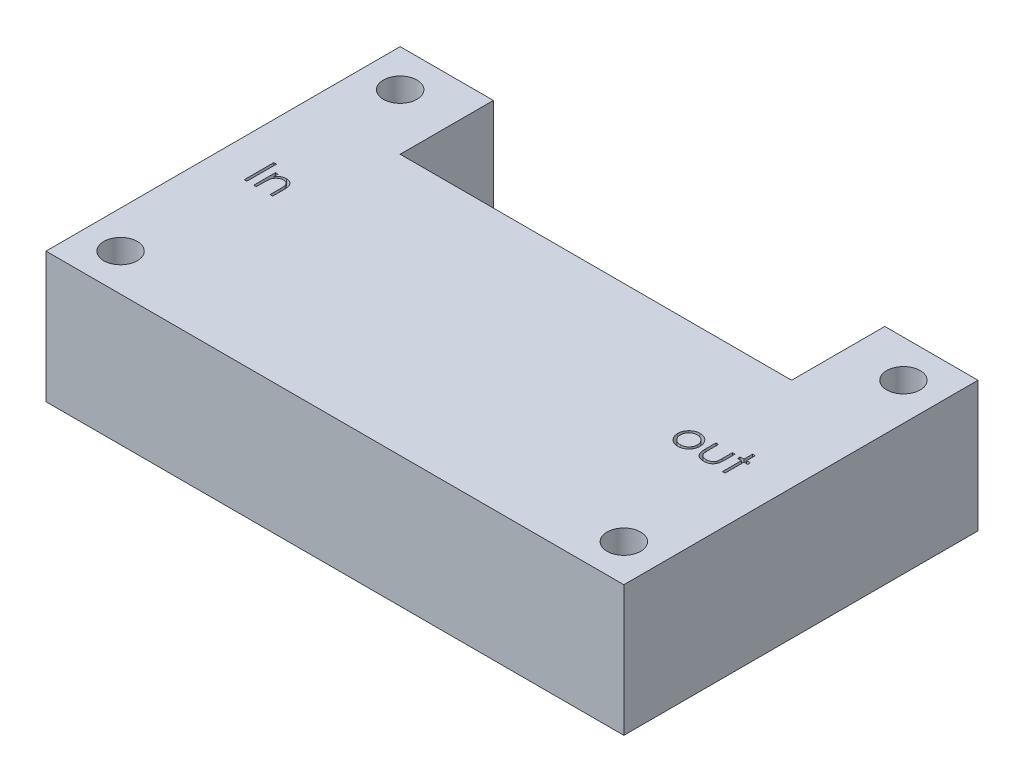
from build123d import *

# Parameters (mm, degrees)
ESQUISSE1_W             = 62
ESQUISSE1_H             = 38
BOSS_EXTRU_1_DEPTH      = 14
ESQUISSE2_W             = 42
ESQUISSE2_H             = 10
ENL_V_MAT_EXTRU_1_DEPTH = 14
D_GAGEMENT_M31_D        = 3.6
ESQUISSE5_W             = 0.284935897
ESQUISSE5_H             = 3.175
ENL_V_MAT_EXTRU_2_DEPTH = 12


with BuildPart() as part:
    # Esquisse1 → Boss.-Extru.1 (new body)
    with BuildSketch(Plane(origin=(0, 0, 0), x_dir=(1, 0, 0), z_dir=(0, 1, 0))):
        Rectangle(ESQUISSE1_W, ESQUISSE1_H)
    extrude(amount=BOSS_EXTRU_1_DEPTH)

    # Esquisse2 → Enlèv. mat.-Extru.1 (cut)
    with BuildSketch(Plane(origin=(0, 14, 0), x_dir=(1, 0, 0), z_dir=(0, 1, 0))):
        with Locations((0, 14)):
            Rectangle(ESQUISSE2_W, ESQUISSE2_H)
    extrude(amount=-ENL_V_MAT_EXTRU_1_DEPTH, mode=Mode.SUBTRACT)

    # Dégagement M31 (through all)
    with Locations(Plane(origin=(0, 14, 0), x_dir=(1, 0, 0), z_dir=(0, 1, 0))):
        with Locations((-27, 15), (27, 15), (27, -15), (-27, -15)):
            Hole(D_GAGEMENT_M31_D / 2)

    # Esquisse5 → Enlèv. mat.-Extru.2 (cut)
    # profile 1 of 5: a face of its own
    with BuildSketch(Plane(origin=(0, 14, 0), x_dir=(1, 0, 0), z_dir=(0, 1, 0))):
        with Locations((-26.85828324, -0.141729763)):
            Rectangle(ESQUISSE5_W, ESQUISSE5_H)
    # profile 2 of 5: a face of its own
    with BuildSketch(Plane(origin=(0, 14, 0), x_dir=(1, 0, 0), z_dir=(0, 1, 0))):
        with BuildLine():
            Line((-25.983122983, 0.590962545), (-25.698187085, 0.590962545))
            Line((-25.698187085, 0.590962545), (-25.698187085, 0.172462945))
            add(Edge.make_bspline(
                [(-25.698187085, 0.172462945), (-25.667763659, 0.210420273), (-25.608725939, 0.28407779), (-25.510405866, 0.380888597), (-25.406498185, 0.46066748), (-25.297639224, 0.524261636), (-25.183681208, 0.572201075), (-25.065318777, 0.606823027), (-24.941843294, 0.627582836), (-24.857874126, 0.630295402), (-24.815394618, 0.631667673)],
                knots=[0, 0, 0, 0, 1.12780773, 2.188550248, 3.19190651, 4.159438251, 5.104880172, 6.052711206, 7.014878035, 8, 8, 8, 8], degree=3))
            add(Edge.make_bspline(
                [(-24.815394618, 0.631667673), (-24.772458971, 0.630084531), (-24.688423554, 0.626985941), (-24.566069884, 0.602477943), (-24.451794019, 0.560617605), (-24.346003422, 0.503275226), (-24.250638022, 0.431967926), (-24.166886192, 0.348893795), (-24.097613818, 0.253338919), (-24.051170496, 0.164690056), (-24.020576515, 0.086050936), (-24.001315752, 0.018698527), (-23.984959076, -0.056338653), (-23.970778847, -0.138833852), (-23.961183896, -0.229365067), (-23.953616246, -0.327561188), (-23.948192716, -0.433390406), (-23.947977535, -0.506584704), (-23.947866573, -0.544328922)],
                knots=[0, 0, 0, 0, 1.235846778, 2.418850247, 3.575807741, 4.728682307, 5.871620074, 6.994088408, 8.11269785, 9.256955736, 9.865816715, 10.540099792, 11.271859618, 12.076849838, 12.949306005, 13.892391288, 14.913166135, 16, 16, 16, 16], degree=3))
            Line((-23.947866573, -0.544328922), (-23.947866573, -1.729229763))
            Line((-23.947866573, -1.729229763), (-24.23280247, -1.729229763))
            Line((-24.23280247, -1.729229763), (-24.23280247, -0.637823513))
            add(Edge.make_bspline(
                [(-24.23280247, -0.637823513), (-24.232977737, -0.606234581), (-24.233312994, -0.545810329), (-24.234370402, -0.459297001), (-24.236919298, -0.380841319), (-24.240500982, -0.31063085), (-24.245743388, -0.248733013), (-24.251206775, -0.195021741), (-24.257887861, -0.149565227), (-24.263841361, -0.122201188), (-24.266511404, -0.109928881)],
                knots=[0, 0, 0, 0, 1.430800155, 2.736877192, 3.918605307, 4.986035426, 5.920637409, 6.731861385, 7.431261377, 8, 8, 8, 8], degree=3))
            add(Edge.make_bspline(
                [(-24.266511404, -0.109928881), (-24.276150279, -0.073905164), (-24.294702132, -0.004570653), (-24.340543673, 0.089476796), (-24.398432252, 0.169485152), (-24.469096729, 0.23495975), (-24.551854534, 0.285914723), (-24.646476013, 0.321269667), (-24.752048066, 0.343382426), (-24.826301684, 0.345584181), (-24.865003993, 0.346731776)],
                knots=[0, 0, 0, 0, 1.084156227, 2.086665306, 3.027808233, 3.945421172, 4.874247719, 5.839848303, 6.874090471, 8, 8, 8, 8], degree=3))
            add(Edge.make_bspline(
                [(-24.865003993, 0.346731776), (-24.887925391, 0.346299971), (-24.933286247, 0.345445442), (-25.000550864, 0.336871764), (-25.065796364, 0.322848737), (-25.129677554, 0.303917901), (-25.190916767, 0.277917129), (-25.251481517, 0.248408343), (-25.309091224, 0.211625322), (-25.364974306, 0.170630972), (-25.41696521, 0.125201977), (-25.465341631, 0.077264457), (-25.508465407, 0.026214445), (-25.547534848, -0.027125507), (-25.581260844, -0.08348796), (-25.610700431, -0.142329152), (-25.63567924, -0.20372653), (-25.648091397, -0.246339621), (-25.654301869, -0.267661253)],
                knots=[0, 0, 0, 0, 1.023777757, 2.026029729, 3.023749952, 4.003683103, 4.997618607, 5.993177895, 7.010360494, 8.046726602, 9.087585522, 10.09234134, 11.086953743, 12.070360549, 13.043493632, 14.017870808, 15.008233677, 16, 16, 16, 16], degree=3))
            add(Edge.make_bspline(
                [(-25.654301869, -0.267661253), (-25.657875693, -0.283314187), (-25.665655721, -0.317389806), (-25.674058749, -0.373310101), (-25.681685621, -0.437998436), (-25.688069147, -0.511379323), (-25.691974775, -0.593709681), (-25.696233264, -0.684637906), (-25.697783626, -0.78452657), (-25.698048833, -0.854069677), (-25.698187085, -0.890322511)],
                knots=[0, 0, 0, 0, 0.615963638, 1.340920617, 2.168419149, 3.115676021, 4.16674242, 5.331190069, 6.6087489, 8, 8, 8, 8], degree=3))
            Line((-25.698187085, -0.890322511), (-25.698187085, -1.729229763))
            Line((-25.698187085, -1.729229763), (-25.983122983, -1.729229763))
            Line((-25.983122983, -1.729229763), (-25.983122983, 0.590962545))
        make_face()
    # profile 3 of 5: a face of its own
    with BuildSketch(Plane(origin=(0, 14, 0), x_dir=(1, 0, 0), z_dir=(0, 1, 0))):
        with BuildLine():
            add(Edge.make_bspline(
                [(21.034202405, -0.847181385), (21.077737345, -0.848108386), (21.163098724, -0.849926009), (21.288110163, -0.869352442), (21.407440394, -0.89905898), (21.521546439, -0.940126754), (21.628966936, -0.995173952), (21.731266565, -1.060859523), (21.828164851, -1.138676591), (21.886242885, -1.198872838), (21.915722838, -1.22942798)],
                knots=[0, 0, 0, 0, 1.054011418, 2.066658804, 3.057071809, 4.030435133, 4.997543892, 5.974964718, 6.972108034, 8, 8, 8, 8], degree=3))
            add(Edge.make_bspline(
                [(21.915722838, -1.22942798), (21.941106467, -1.258650667), (21.991382484, -1.316530502), (22.055849243, -1.410379522), (22.111385944, -1.507570899), (22.155893059, -1.609395259), (22.190985901, -1.714963711), (22.215901212, -1.824639107), (22.230721145, -1.938179236), (22.232719551, -2.015289861), (22.233731652, -2.054342843)],
                knots=[0, 0, 0, 0, 1.025258237, 2.030674902, 3.01204498, 3.988269485, 4.97094183, 5.956517959, 6.965070386, 8, 8, 8, 8], degree=3))
            add(Edge.make_bspline(
                [(22.233731652, -2.054342843), (22.232841439, -2.093622181), (22.231082336, -2.171239985), (22.214442055, -2.285557553), (22.188560285, -2.396405713), (22.151519974, -2.503320386), (22.104023689, -2.606628379), (22.046065709, -2.70587847), (21.977239313, -2.801266477), (21.899221402, -2.89198243), (21.812995771, -2.975590353), (21.719454694, -3.048459569), (21.620436392, -3.110890524), (21.514624207, -3.161179272), (21.402984415, -3.200830215), (21.285276218, -3.228679515), (21.161682475, -3.245517614), (21.077293496, -3.247679855), (21.034202405, -3.248783949)],
                knots=[0, 0, 0, 0, 0.998656419, 1.973391657, 2.932242238, 3.890759089, 4.846373663, 5.82037756, 6.809684879, 7.83454468, 8.860553229, 9.859544525, 10.845671541, 11.83227036, 12.833544569, 13.85385346, 14.904124723, 16, 16, 16, 16], degree=3))
            add(Edge.make_bspline(
                [(21.034202405, -3.248783949), (20.990900195, -3.24767615), (20.906090629, -3.245506469), (20.782060632, -3.228744934), (20.664141477, -3.200843049), (20.552355534, -3.161048967), (20.446088423, -3.110888916), (20.346496387, -3.048648312), (20.25287932, -2.975568743), (20.166635449, -2.891988286), (20.088622428, -2.801264968), (20.019794771, -2.705878862), (19.961837118, -2.606628277), (19.914340747, -2.503320413), (19.87730046, -2.396405706), (19.851418683, -2.285557555), (19.834778404, -2.171239985), (19.833019301, -2.093622181), (19.832129088, -2.054342843)],
                knots=[0, 0, 0, 0, 1.099876186, 2.154163076, 3.173186993, 4.173200201, 5.163417411, 6.152872554, 7.150605724, 8.17532212, 9.198891216, 10.186952605, 11.159729845, 12.11414092, 13.071450619, 14.029093627, 15.002601286, 16, 16, 16, 16], degree=3))
            add(Edge.make_bspline(
                [(19.832129088, -2.054342843), (19.833148091, -2.01550212), (19.835165541, -1.938604162), (19.849970575, -1.825277471), (19.874788694, -1.715787697), (19.909923603, -1.610626729), (19.954840955, -1.509248584), (20.009597266, -1.411817058), (20.074721626, -1.318392411), (20.124797682, -1.260587381), (20.150137902, -1.231336033)],
                knots=[0, 0, 0, 0, 1.031353054, 2.041901799, 3.029428768, 4.008703097, 4.981709435, 5.96992636, 6.972712378, 8, 8, 8, 8], degree=3))
            add(Edge.make_bspline(
                [(20.150137902, -1.231336033), (20.179573409, -1.200515909), (20.237463514, -1.139902713), (20.334844146, -1.062312495), (20.436892112, -0.995260057), (20.545499724, -0.941306633), (20.659512031, -0.898817406), (20.779453772, -0.869275831), (20.904889418, -0.849996002), (20.990668503, -0.848128941), (21.034202405, -0.847181385)],
                knots=[0, 0, 0, 0, 1.027980169, 2.021703884, 2.998553061, 3.971491411, 4.943284454, 5.930300938, 6.949603206, 8, 8, 8, 8], degree=3))
        make_face()
        with BuildLine():
            add(Edge.make_bspline(
                [(21.03293037, -1.132117283), (21.002144108, -1.132992305), (20.941366327, -1.134719761), (20.851904275, -1.147858732), (20.765779993, -1.168675396), (20.682830084, -1.198251933), (20.603334278, -1.236441649), (20.527216463, -1.283348518), (20.454252749, -1.338351272), (20.385870449, -1.401363838), (20.323112209, -1.470196926), (20.268250044, -1.543537937), (20.221600126, -1.620197266), (20.182737982, -1.700254629), (20.153793604, -1.784521318), (20.132772362, -1.872043034), (20.119645787, -1.96299809), (20.117934572, -2.024829871), (20.117064985, -2.056250896)],
                knots=[0, 0, 0, 0, 1.021534396, 2.016698045, 2.994645724, 3.958388632, 4.93408049, 5.916473867, 6.921342795, 7.962252576, 8.998418191, 10.008913653, 10.997312074, 11.973003931, 12.956656626, 13.948281152, 14.957379055, 16, 16, 16, 16], degree=3))
            add(Edge.make_bspline(
                [(20.117064985, -2.056250896), (20.118522604, -2.096847378), (20.121415704, -2.177423803), (20.144942668, -2.296088179), (20.184300222, -2.410008859), (20.237447255, -2.518518009), (20.304037182, -2.618913575), (20.382493306, -2.708422708), (20.471973606, -2.785698408), (20.571411431, -2.849816032), (20.678775705, -2.900760954), (20.792401082, -2.93686431), (20.910910855, -2.960333631), (20.991901232, -2.962666326), (21.03293037, -2.963848052)],
                knots=[0, 0, 0, 0, 1.016792936, 2.018143844, 3.017858371, 4.030088057, 5.03801393, 6.028138512, 7.003788237, 7.991172063, 8.984598303, 9.972568034, 10.972917682, 12, 12, 12, 12], degree=3))
            add(Edge.make_bspline(
                [(21.03293037, -2.963848052), (21.073957147, -2.96265944), (21.154942866, -2.960313155), (21.273287977, -2.936982511), (21.386602794, -2.900602762), (21.493855553, -2.849873328), (21.593248115, -2.785454924), (21.68337196, -2.708859067), (21.7611582, -2.618676502), (21.827682256, -2.518385029), (21.881699659, -2.410177081), (21.920872992, -2.296067153), (21.944456516, -2.177429158), (21.947341982, -2.096849172), (21.948795754, -2.056250896)],
                knots=[0, 0, 0, 0, 1.02726834, 2.027799167, 3.010890988, 4.004497153, 4.992059811, 5.971914811, 6.958719428, 7.966827853, 8.981595046, 9.981490638, 10.983022906, 12, 12, 12, 12], degree=3))
            add(Edge.make_bspline(
                [(21.948795754, -2.056250896), (21.947926466, -2.024829683), (21.946215841, -1.962997533), (21.93308498, -1.872045164), (21.912079598, -1.784513502), (21.883076774, -1.70028347), (21.84438349, -1.619989984), (21.79683397, -1.543763017), (21.742195826, -1.469942865), (21.678680295, -1.401586348), (21.610369373, -1.338326707), (21.537376089, -1.28332719), (21.461371144, -1.2366478), (21.382106287, -1.197925282), (21.299145743, -1.16894448), (21.213142133, -1.147738536), (21.124061784, -1.134775286), (21.063501795, -1.13300895), (21.03293037, -1.132117283)],
                knots=[0, 0, 0, 0, 1.042956736, 2.052379634, 3.044323526, 4.02829302, 5.004299113, 5.996692471, 7.007513377, 8.048758398, 9.090003419, 10.095195979, 11.07790575, 12.047570684, 13.018257071, 13.989683339, 14.985167495, 16, 16, 16, 16], degree=3))
        make_face(mode=Mode.SUBTRACT)
    # profile 4 of 5: a face of its own
    with BuildSketch(Plane(origin=(0, 14, 0), x_dir=(1, 0, 0), z_dir=(0, 1, 0))):
        with BuildLine():
            Line((22.762898318, -0.887886513), (23.047834216, -0.887886513))
            Line((23.047834216, -0.887886513), (23.047834216, -1.96402834))
            add(Edge.make_bspline(
                [(23.047834216, -1.96402834), (23.047962944, -1.995617548), (23.048209195, -2.056046224), (23.049879191, -2.143000572), (23.053807204, -2.222300018), (23.058718317, -2.293990373), (23.065033969, -2.358059506), (23.07254816, -2.414283637), (23.080946871, -2.463300361), (23.089168047, -2.492821834), (23.092991467, -2.506551377)],
                knots=[0, 0, 0, 0, 1.388932606, 2.656963016, 3.823490214, 4.879454478, 5.816252168, 6.653371382, 7.373723809, 8, 8, 8, 8], degree=3))
            add(Edge.make_bspline(
                [(23.092991467, -2.506551377), (23.099125073, -2.523807839), (23.111264768, -2.557962004), (23.133284286, -2.607300602), (23.160524277, -2.652998179), (23.190332835, -2.696816874), (23.224713012, -2.737458676), (23.263229818, -2.774854954), (23.304593933, -2.810418666), (23.366057418, -2.852496298), (23.450112609, -2.897595205), (23.560469037, -2.93650784), (23.680125014, -2.959763191), (23.762824438, -2.962461265), (23.805331211, -2.963848052)],
                knots=[0, 0, 0, 0, 0.725840625, 1.436591201, 2.137033971, 2.831655856, 3.53531722, 4.242432219, 4.957935707, 5.694543706, 7.190802206, 8.724350549, 10.316345118, 12, 12, 12, 12], degree=3))
            add(Edge.make_bspline(
                [(23.805331211, -2.963848052), (23.847834036, -2.962431776), (23.930069138, -2.959691545), (24.048410431, -2.937209335), (24.1565885, -2.89964846), (24.253517577, -2.847208879), (24.338758018, -2.783035722), (24.409791312, -2.707734875), (24.468399322, -2.623688645), (24.493989296, -2.560983049), (24.506858655, -2.529448012)],
                knots=[0, 0, 0, 0, 1.157059328, 2.238695713, 3.266970494, 4.264342957, 5.228770407, 6.160125903, 7.074715775, 8, 8, 8, 8], degree=3))
            add(Edge.make_bspline(
                [(24.506858655, -2.529448012), (24.510663421, -2.516778584), (24.519074829, -2.488769572), (24.528112105, -2.441253658), (24.536253224, -2.384589338), (24.543204819, -2.31840582), (24.548162502, -2.24287606), (24.550834969, -2.158023663), (24.55385419, -2.064115), (24.553900016, -1.99837639), (24.553923959, -1.96402834)],
                knots=[0, 0, 0, 0, 0.557542046, 1.232589297, 2.036731608, 2.971723315, 4.038036528, 5.22795436, 6.551621927, 8, 8, 8, 8], degree=3))
            Line((24.553923959, -1.96402834), (24.553923959, -0.887886513))
            Line((24.553923959, -0.887886513), (24.838859857, -0.887886513))
            Line((24.838859857, -0.887886513), (24.838859857, -2.017453821))
            add(Edge.make_bspline(
                [(24.838859857, -2.017453821), (24.838459177, -2.055832469), (24.837681802, -2.130292297), (24.832685855, -2.238500027), (24.824113706, -2.339340063), (24.811102842, -2.432865784), (24.795803266, -2.519005785), (24.776067218, -2.597870469), (24.752501245, -2.66921685), (24.725916957, -2.73429689), (24.694509977, -2.793303716), (24.661102608, -2.849306921), (24.622526565, -2.90091694), (24.581913567, -2.950702879), (24.53673635, -2.996188408), (24.487841478, -3.038417246), (24.435917148, -3.078034925), (24.379811089, -3.1134963), (24.320342375, -3.145442828), (24.257437591, -3.173760271), (24.190326256, -3.196169037), (24.119874243, -3.215500855), (24.045736379, -3.230663267), (23.967984137, -3.241355366), (23.886643706, -3.247909774), (23.831208696, -3.248487664), (23.802787141, -3.248783949)],
                knots=[0, 0, 0, 0, 1.493040784, 2.896703357, 4.213163133, 5.428574705, 6.569057535, 7.615249723, 8.588095153, 9.490268104, 10.346124644, 11.18633936, 12.024365274, 12.850166724, 13.684164916, 14.514361689, 15.362232829, 16.222528818, 17.093394965, 17.986930858, 18.902426812, 19.842810585, 20.827885679, 21.843828298, 22.894529745, 24, 24, 24, 24], degree=3))
            add(Edge.make_bspline(
                [(23.802787141, -3.248783949), (23.77457816, -3.248475786), (23.719144887, -3.247870218), (23.637800258, -3.241391578), (23.559832594, -3.23067988), (23.485519089, -3.21538979), (23.414785172, -3.196304348), (23.347344326, -3.173622569), (23.283986236, -3.145428132), (23.223949704, -3.113698491), (23.167704681, -3.077807134), (23.114991899, -3.038466127), (23.06588204, -2.995734198), (23.020364271, -2.94978981), (22.9790775, -2.900063017), (22.941507233, -2.846953831), (22.907075079, -2.790988479), (22.875912191, -2.731059753), (22.849140813, -2.665226572), (22.825504982, -2.592385634), (22.806173189, -2.511738351), (22.790441093, -2.423353673), (22.777785143, -2.3276546), (22.768998428, -2.224087537), (22.764085496, -2.11290476), (22.763302576, -2.036115216), (22.762898318, -1.996465239)],
                knots=[0, 0, 0, 0, 1.083640291, 2.129454052, 3.13281866, 4.105697902, 5.042300162, 5.946461698, 6.836384745, 7.703652036, 8.553297018, 9.397182691, 10.228592656, 11.052265423, 11.879314572, 12.708807002, 13.549817954, 14.402308542, 15.300838682, 16.27712199, 17.341985831, 18.484375296, 19.725102775, 21.0496083, 22.476576903, 24, 24, 24, 24], degree=3))
            Line((22.762898318, -1.996465239), (22.762898318, -0.887886513))
        make_face()
    # profile 5 of 5: a face of its own
    with BuildSketch(Plane(origin=(0, 14, 0), x_dir=(1, 0, 0), z_dir=(0, 1, 0))):
        Polygon((25.775077806, 0.048331435), (26.060013703, 0.048331435), (26.060013703, -0.887886513), (26.467064985, -0.887886513), (26.467064985, -1.172822411), (26.060013703, -1.172822411), (26.060013703, -3.208078821), (25.775077806, -3.208078821), (25.775077806, -1.172822411), (25.368026524, -1.172822411), (25.368026524, -0.887886513), (25.775077806, -0.887886513), align=None)
    extrude(amount=-ENL_V_MAT_EXTRU_2_DEPTH, mode=Mode.SUBTRACT)


solid = part.part
